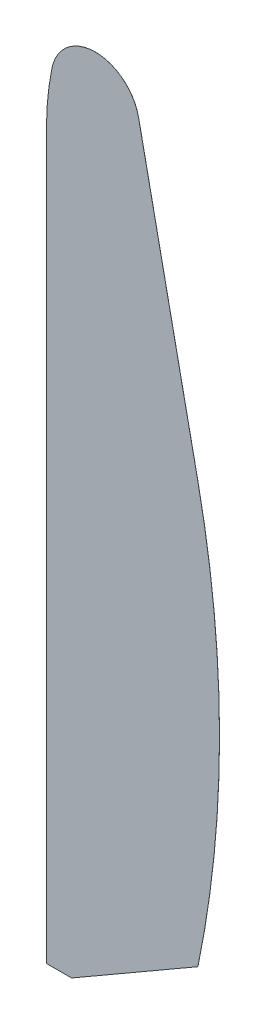
from build123d import *

# Parameters (mm, degrees)
BOSS_EXTRUDE1_DEPTH = 0.01


with BuildPart() as part:
    # Sketch1 → Boss-Extrude1 (new body)
    with BuildSketch(Plane(origin=(0, 0, 0), x_dir=(0, 1, 0), z_dir=(0, 0, 1))):
        with BuildLine():
            Line((0, 0), (144.15, 0))
            ThreePointArc((144.15, 0), (149.603617969, -0.279715962), (155, -1.115928218))
            ThreePointArc((155, -1.115928218), (162.004987173, -9.727039329), (155, -18.33815044))
            Line((155, -18.33815044), (98.238465305, -30.138888889))
            ThreePointArc((98.238465305, -30.138888889), (56.376204786, -34.444444444), (14.513944267, -30.138888889))
            Line((14.513944267, -30.138888889), (0, -5))
            Line((0, -5), (0, 0))
        make_face()
    extrude(amount=BOSS_EXTRUDE1_DEPTH)


solid = part.part
